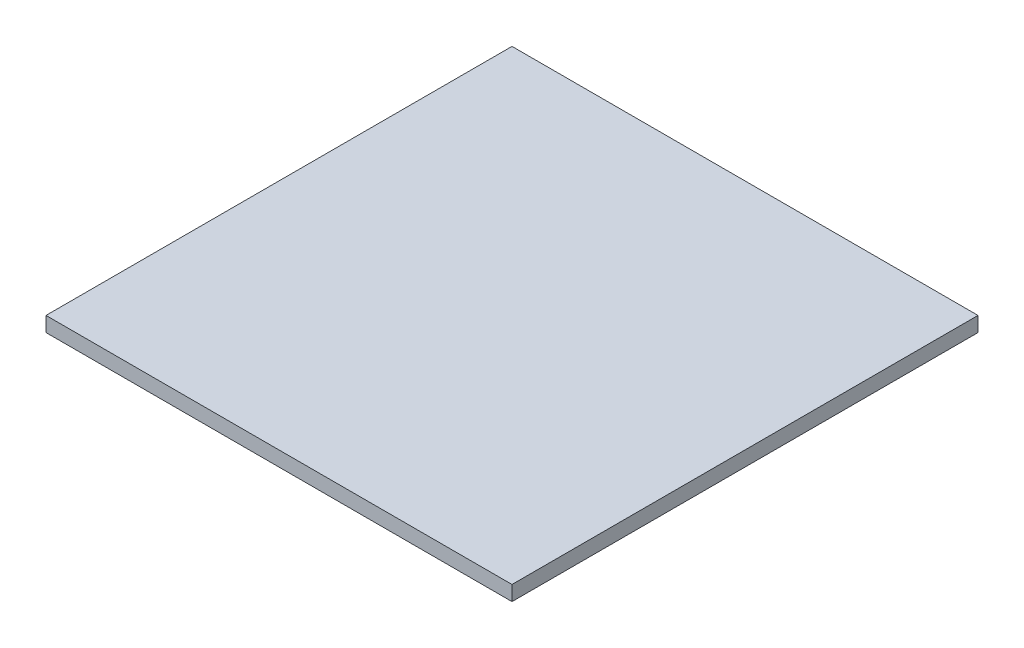
from build123d import *

# Parameters (mm, degrees)
SKETCH1_W           = 94
SKETCH1_H           = 94
BOSS_EXTRUDE1_DEPTH = 3


with BuildPart() as part:
    # Sketch1 → Boss-Extrude1 (new body)
    with BuildSketch(Plane(origin=(0, 0, 0), x_dir=(1, 0, 0), z_dir=(0, 1, 0))):
        Rectangle(SKETCH1_W, SKETCH1_H)
    extrude(amount=BOSS_EXTRUDE1_DEPTH)


solid = part.part
